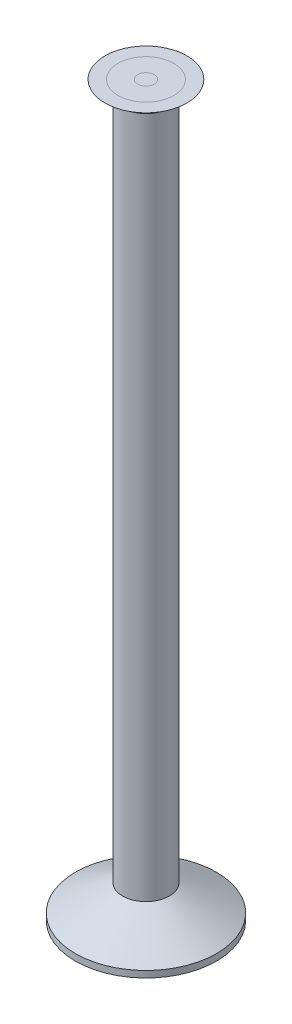
from build123d import *


with BuildPart() as part:
    # Croquis1 → Revolución1 (revolve)
    with BuildSketch(Plane.XY, mode=Mode.PRIVATE) as revoluci_n1_sk:
        Polygon((5.375, 0), (5.375, 0.5), (1.78, 2.5), (1.78, 54.5), (3.11963605, 55.5), (2.12525, 55.5), (1.375, 54.939959831), (1.375, 0), align=None)
        Polygon((0.375, 0), (0.375, 54.939959831), (0.630483851, 55.130671219), (0.630483851, 55.5), (0, 55.5), (0, 0), align=None)
    revolve(revoluci_n1_sk.sketch.rotate(Axis((0, 55.5, 0), (0, -1, 0)), 90), axis=Axis((0, 55.5, 0), (0, -1, 0)))


with BuildPart() as body_2:
    # Croquis3 → Revolución2 (revolve)
    with BuildSketch(Plane.XY, mode=Mode.PRIVATE) as revoluci_n2_sk:
        Polygon((0.375, 54.939959831), (0.630483851, 55.130671219), (0.630483851, 55.5), (2.12525, 55.5), (1.375, 54.939959831), (1.375, 0), (0.375, 0), align=None)
    revolve(revoluci_n2_sk.sketch.rotate(Axis((0, 55.5, 0), (0, -1, 0)), 270), axis=Axis((0, 55.5, 0), (0, -1, 0)))


solid = Compound([part.part, body_2.part])
